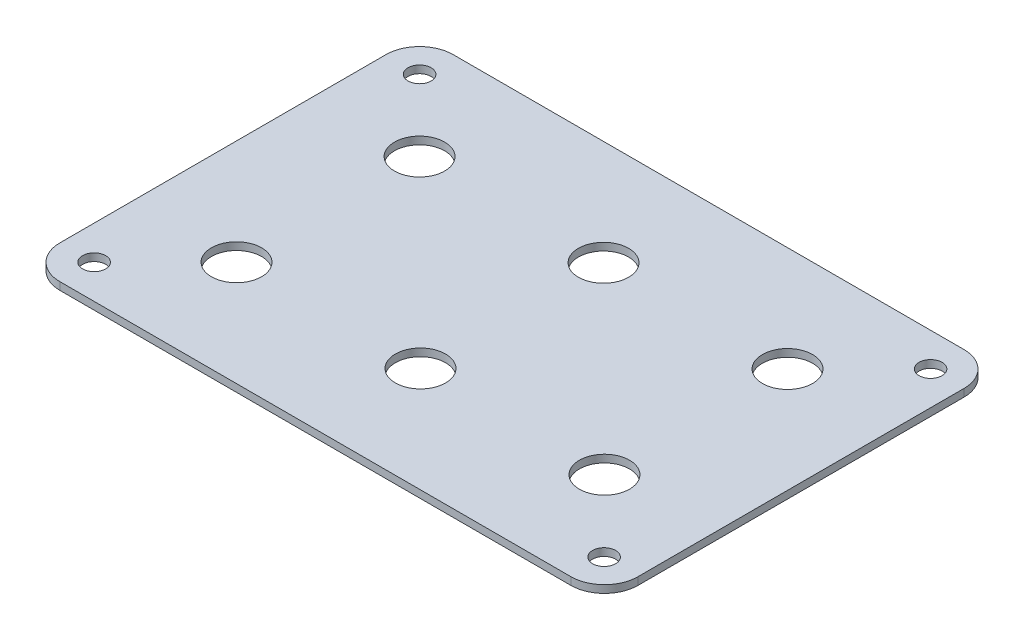
from build123d import *

# Parameters (mm, degrees)
SKETCH1_R           = 10.489994049
SKETCH1_R_2         = 10.489997864
SKETCH1_R_3         = 10.489990234
SKETCH1_R_4         = 4.819997787
SKETCH1_R_5         = 4.82000351
SKETCH1_R_6         = 4.820007324
BOSS_EXTRUDE1_DEPTH = 3.175


with BuildPart() as part:
    # Sketch1 → Boss-Extrude1 (new body)
    with BuildSketch(Plane(origin=(0, 0, 0), x_dir=(1, 0, 0), z_dir=(0, 1, 0))):
        with BuildLine():
            Line((304.690002441, 389.299987793), (91.089996338, 389.299987793))
            add(Edge.make_bspline(
                [(91.089996338, 389.299987793), (83.329994202, 389.299987793), (77.039993286, 395.589996338), (77.039993286, 403.349975586)],
                knots=[1, 1, 1, 1, 2, 2, 2, 2], degree=3))
            Line((77.039993286, 403.349975586), (77.039993286, 539.660003662))
            add(Edge.make_bspline(
                [(77.039993286, 539.660003662), (77.039993286, 547.419998169), (83.329994202, 553.710006714), (91.089996338, 553.710006714)],
                knots=[3, 3, 3, 3, 4, 4, 4, 4], degree=3))
            Line((91.089996338, 553.710006714), (304.690002441, 553.710006714))
            add(Edge.make_bspline(
                [(304.690002441, 553.710006714), (312.450012207, 553.710006714), (318.739990234, 547.420013428), (318.739990234, 539.660003662)],
                knots=[5, 5, 5, 5, 6, 6, 6, 6], degree=3))
            Line((318.739990234, 539.660003662), (318.739990234, 403.350006104))
            add(Edge.make_bspline(
                [(318.739990234, 403.350006104), (318.739990234, 395.589996338), (312.450012207, 389.299987793), (304.690002441, 389.299987793)],
                knots=[7, 7, 7, 7, 8, 8, 8, 8], degree=3))
        make_face()
        with Locations(Location((120.980003357, 509.769989014, 0), (0, 0, 270))):
            Circle(SKETCH1_R, mode=Mode.SUBTRACT)
        with Locations(Location((197.88999939, 509.769989014, 0), (0, 0, 270))):
            Circle(SKETCH1_R_2, mode=Mode.SUBTRACT)
        with Locations(Location((274.809997559, 509.769989014, 0), (0, 0, 270))):
            Circle(SKETCH1_R_3, mode=Mode.SUBTRACT)
        with Locations(Location((120.980003357, 433.239990234, 0), (0, 0, 270))):
            Circle(SKETCH1_R, mode=Mode.SUBTRACT)
        with Locations(Location((197.88999939, 433.239990234, 0), (0, 0, 270))):
            Circle(SKETCH1_R_2, mode=Mode.SUBTRACT)
        with Locations(Location((274.809997559, 433.239990234, 0), (0, 0, 270))):
            Circle(SKETCH1_R_3, mode=Mode.SUBTRACT)
        with Locations(Location((91.220001221, 539.539997101, 0), (0, 0, 270))):
            Circle(SKETCH1_R_4, mode=Mode.SUBTRACT)
        with Locations(Location((91.220001221, 403.480010986, 0), (0, 0, 270))):
            Circle(SKETCH1_R_5, mode=Mode.SUBTRACT)
        with Locations(Location((304.570007324, 403.329986572, 0), (0, 0, 270))):
            Circle(SKETCH1_R_6, mode=Mode.SUBTRACT)
        with Locations(Location((304.709991455, 539.679992676, 0), (0, 0, 270))):
            Circle(SKETCH1_R_6, mode=Mode.SUBTRACT)
    extrude(amount=BOSS_EXTRUDE1_DEPTH)


solid = part.part
